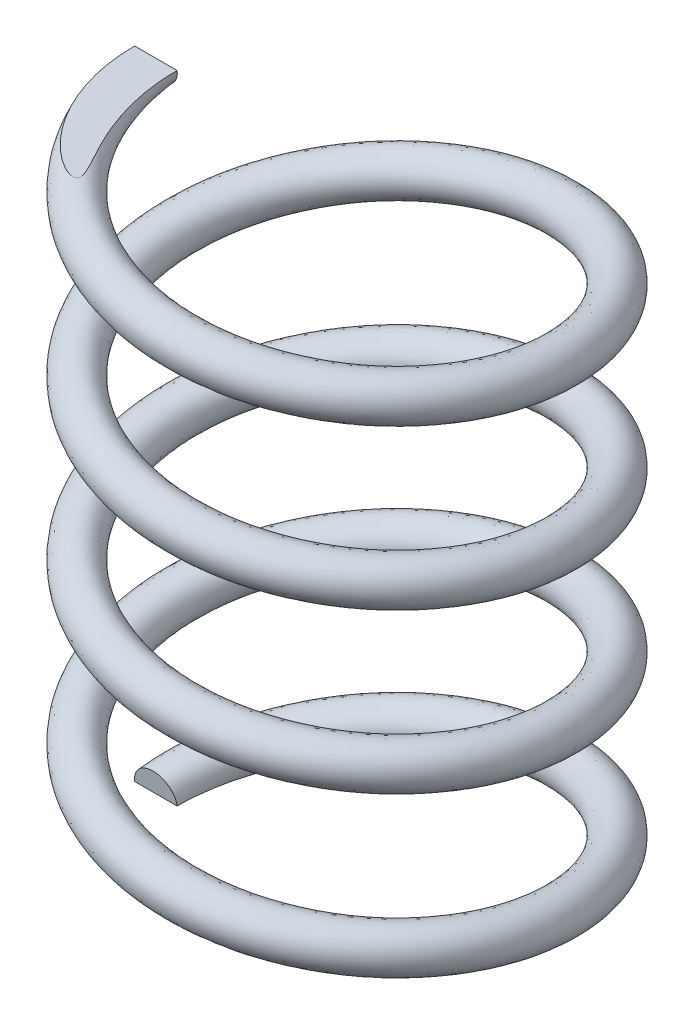
from build123d import *

# Parameters (mm, degrees)
SWEEP1_PITCH       = 3.75
SWEEP1_HEIGHT      = 15
SWEEP1_RADIUS      = 4.5
SWEEP1_START_ANGLE = -90
SWEEP1_PROFILE_R   = 0.5
SKETCH15_W         = 14.055552012
SKETCH15_H         = 2.489198618
SKETCH15_H_2       = 2.81435661
CUT_EXTRUDE1_DEPTH = 10


with BuildPart() as part:
    # Sweep1: sweep along a helix
    with BuildLine() as sweep1_path:
        add(Helix(SWEEP1_PITCH, SWEEP1_HEIGHT, SWEEP1_RADIUS, center=(0, 0, 0), direction=(0, 1, 0), lefthand=True, mode=Mode.PRIVATE).rotate(Axis((0, 0, 0), (0, 1, 0)), SWEEP1_START_ANGLE))
    # Sweep1 profile (on start of the path) → Sweep1 (sweep)
    with BuildSketch(Plane(origin=(-4.5, 0, 0), x_dir=(0, -0.9913191176317669, -0.1314777814605003), z_dir=(-4.0976840606916e-13, 0.1314777814605003, -0.9913191176317669))):
        Circle(SWEEP1_PROFILE_R)
    sweep(path=sweep1_path.line, is_frenet=True)

    # Sketch15 → Cut-Extrude1 (cut, symmetric)
    with BuildSketch(Plane(origin=(0, 0, 0), x_dir=(0, 0, -1), z_dir=(1, 0, 0))):
        with Locations((0, 16.244599309)):
            Rectangle(SKETCH15_W, SKETCH15_H)
        with Locations((0, -1.407178305)):
            Rectangle(SKETCH15_W, SKETCH15_H_2)
    extrude(amount=CUT_EXTRUDE1_DEPTH, both=True, mode=Mode.SUBTRACT)


solid = part.part
